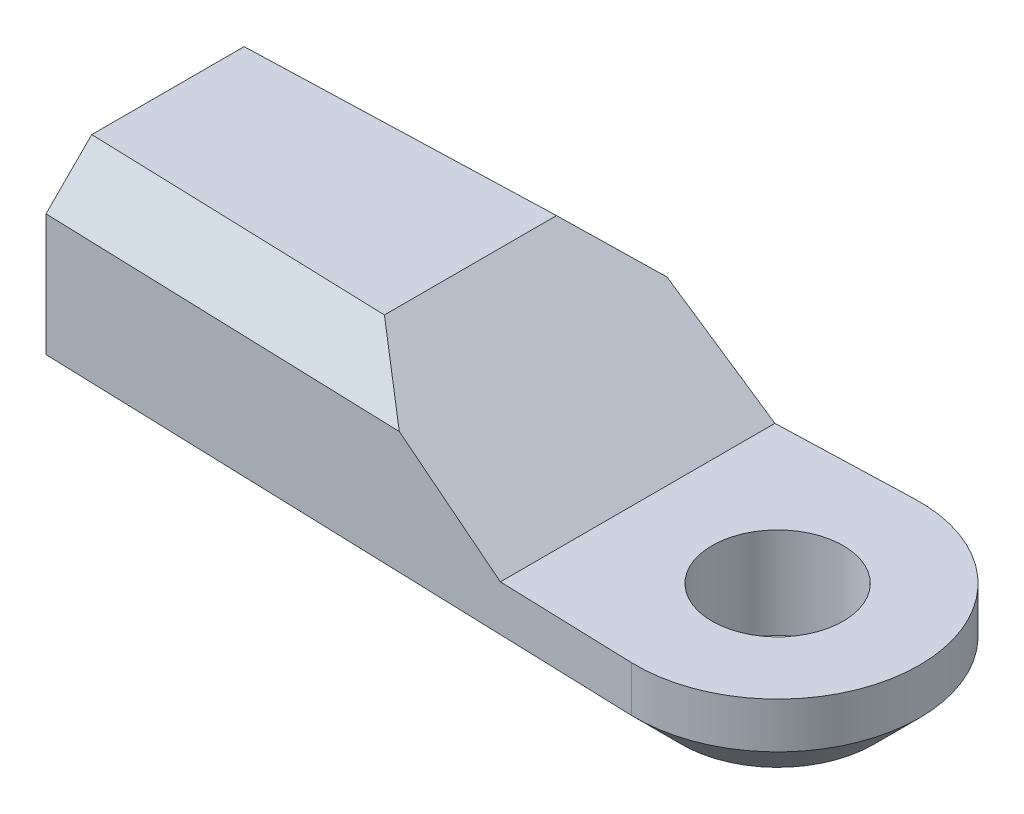
from build123d import *

# Parameters (mm, degrees)
SKETCH8_R               = 2.15
BOSS_EXTRUDE2_DEPTH     = 7
SKETCH9_R               = 1.975
CUT_EXTRUDE5_DEPTH      = 10
CUT_EXTRUDE6_DEPTH      = 10
CUT_EXTRUDE6_DEPTH_BACK = 10
CHAMFER1_SIZE           = 1.5


with BuildPart() as part:
    # Sketch8 → Boss-Extrude2 (new body)
    with BuildSketch(Plane(origin=(0, 0, 0), x_dir=(1, 0, 0), z_dir=(0, 1, 0))):
        with BuildLine():
            Line((0, 4), (0, -4))
            Line((0, -4), (19.848380493, -4.647527464))
            ThreePointArc((19.848380493, -4.647527464), (24.65, 0), (19.848380493, 4.647527464))
            Line((19.848380493, 4.647527464), (0, 4))
        make_face()
        with Locations((20, 0)):
            Circle(SKETCH8_R, mode=Mode.SUBTRACT)
    extrude(amount=BOSS_EXTRUDE2_DEPTH)

    # Sketch9 → Cut-Extrude5 (cut)
    with BuildSketch(Plane.ZY):
        with Locations((0, 3.5)):
            Circle(SKETCH9_R)
    extrude(amount=-CUT_EXTRUDE5_DEPTH, mode=Mode.SUBTRACT)

    # Sketch10 → Cut-Extrude6 (cut, two sides: drawn at the far end of the back side and taken through both)
    with BuildSketch(Plane.XY.offset(-CUT_EXTRUDE6_DEPTH_BACK)):
        Polygon((9.924190246, 7), (15.408042822, 3), (24.65, 3), (24.65, 7), align=None)
    extrude(amount=CUT_EXTRUDE6_DEPTH + CUT_EXTRUDE6_DEPTH_BACK, mode=Mode.SUBTRACT)

    # Chamfer1
    chamfer1_edges = [part.edges().sort_by_distance(p)[0] for p in [
        (9.924190246, 0, 4.323763732),
        (24.65, 0, 0),
        (9.924190246, 0, -4.323763732),
        (4.962095123, 7, -4.161881866),
        (4.962095123, 7, 4.161881866),
    ]]
    chamfer(chamfer1_edges, length=CHAMFER1_SIZE)


solid = part.part
